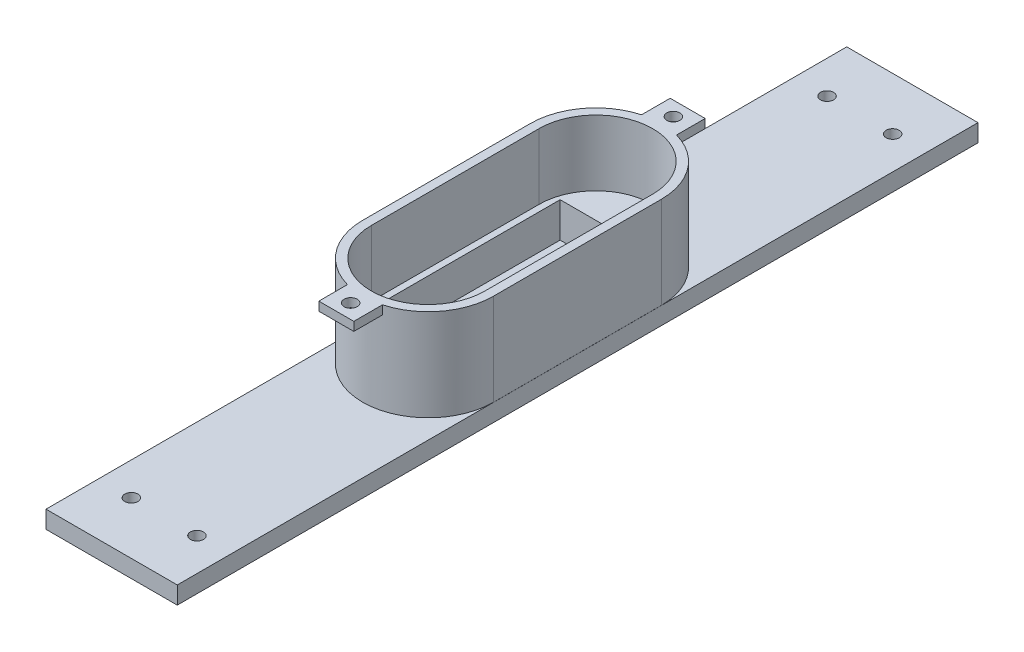
from build123d import *

# Parameters (mm, degrees)
ESQUISSE1_W             = 232.41
ESQUISSE1_H             = 5.08
EXTRU_MINCE1_DEPTH      = 19.05
EXTRU_MINCE2_DEPTH      = 26.67
BOSS_EXTRU_2_DEPTH      = 7.62
ESQUISSE2_W             = 29.21
ESQUISSE2_H             = 57.15
ENL_V_MAT_EXTRU_1_DEPTH = 10.16
ENL_V_MAT_EXTRU_2_REACH = 123.325
ESQUISSE7_R             = 1.65
ESQUISSE8_R             = 10.16
ENL_V_MAT_EXTRU_3_DEPTH = 122.324888729
ESQUISSE9_W             = 10.16
ESQUISSE9_H             = 10.16
BOSS_EXTRU_1_DEPTH      = 2.54
D_GAGEMENT_61_D         = 3.7973
D_GAGEMENT_61_DEPTH     = 2.54
ESQUISSE12_W            = 10.16
ESQUISSE12_H            = 81.28
ENL_V_MAT_EXTRU_4_DEPTH = 3.81
ENL_V_START             = -8.89
ENL_V_MAT_EXTRU_5_DEPTH = 8.89
D_GAGEMENT_62_D         = 3.7973


with BuildPart() as part:
    # Esquisse1 → Extru.-Mince1 (new, symmetric)
    with BuildSketch(Plane(origin=(0, 0, 0), x_dir=(0, 0, -1), z_dir=(1, 0, 0))):
        with Locations((0, 46.628736397)):
            Rectangle(ESQUISSE1_W, ESQUISSE1_H)
    extrude(amount=EXTRU_MINCE1_DEPTH, both=True)

    # Esquisse6 → Extru.-Mince2 (add)
    with BuildSketch(Plane(origin=(0, 49.168736397, 0), x_dir=(1, 0, 0), z_dir=(0, 1, 0))):
        with BuildLine():
            Line((-19.0246, -24.3459), (-19.0246, 24.3459))
            ThreePointArc((-19.0246, 24.3459), (0, 43.3705), (19.0246, 24.3459))
            Line((19.0246, 24.3459), (19.0246, -24.3459))
            ThreePointArc((19.0246, -24.3459), (0, -43.3705), (-19.0246, -24.3459))
        make_face()
        with BuildLine():
            Line((-16.4846, -24.3459), (-16.4846, 24.3459))
            ThreePointArc((-16.4846, 24.3459), (0, 40.8305), (16.4846, 24.3459))
            Line((16.4846, 24.3459), (16.4846, -24.3459))
            ThreePointArc((16.4846, -24.3459), (0, -40.8305), (-16.4846, -24.3459))
        make_face(mode=Mode.SUBTRACT)
    extrude(amount=EXTRU_MINCE2_DEPTH)

    # Esquisse13 → Boss.-Extru.2 (add)
    with BuildSketch(Plane(origin=(0, 49.168736397, 0), x_dir=(1, 0, 0), z_dir=(0, 1, 0))):
        with BuildLine():
            Line((-16.4846, 24.3459), (-16.4846, -24.3459))
            ThreePointArc((-16.4846, -24.3459), (0, -40.8305), (16.4846, -24.3459))
            Line((16.4846, -24.3459), (16.4846, 24.3459))
            ThreePointArc((16.4846, 24.3459), (0, 40.8305), (-16.4846, 24.3459))
        make_face()
    extrude(amount=BOSS_EXTRU_2_DEPTH)

    # Esquisse2 → Enlèv. mat.-Extru.1 (cut)
    with BuildSketch(Plane(origin=(0, 56.788736397, 0), x_dir=(1, 0, 0), z_dir=(0, 1, 0))):
        Rectangle(ESQUISSE2_W, ESQUISSE2_H)
    extrude(amount=-ENL_V_MAT_EXTRU_1_DEPTH, mode=Mode.SUBTRACT)

    # Esquisse7 → Enlèv. mat.-Extru.2 (cut, up to next)
    with BuildSketch(Plane(origin=(0, 46.628736397, 0), x_dir=(1, 0, 0), z_dir=(0, 1, 0)), mode=Mode.PRIVATE) as enl_v_mat_extru_2_sk1:
        with Locations(Location((-9.525, 9.525, 0), (0, 0, 270))):
            Circle(ESQUISSE7_R)
    enl_v_mat_extru_2_tool1 = extrude(enl_v_mat_extru_2_sk1.sketch, amount=-ENL_V_MAT_EXTRU_2_REACH, mode=Mode.PRIVATE) & part.part
    # Esquisse7 → Enlèv. mat.-Extru.2 (cut, up to next)
    with BuildSketch(Plane(origin=(0, 46.628736397, 0), x_dir=(1, 0, 0), z_dir=(0, 1, 0)), mode=Mode.PRIVATE) as enl_v_mat_extru_2_sk2:
        with Locations(Location((9.525, 9.525, 0), (0, 0, 270))):
            Circle(ESQUISSE7_R)
    enl_v_mat_extru_2_tool2 = extrude(enl_v_mat_extru_2_sk2.sketch, amount=-ENL_V_MAT_EXTRU_2_REACH, mode=Mode.PRIVATE) & part.part
    # Esquisse7 → Enlèv. mat.-Extru.2 (cut, up to next)
    with BuildSketch(Plane(origin=(0, 46.628736397, 0), x_dir=(1, 0, 0), z_dir=(0, 1, 0)), mode=Mode.PRIVATE) as enl_v_mat_extru_2_sk3:
        with Locations(Location((9.525, -9.525, 0), (0, 0, 270))):
            Circle(ESQUISSE7_R)
    enl_v_mat_extru_2_tool3 = extrude(enl_v_mat_extru_2_sk3.sketch, amount=-ENL_V_MAT_EXTRU_2_REACH, mode=Mode.PRIVATE) & part.part
    # Esquisse7 → Enlèv. mat.-Extru.2 (cut, up to next)
    with BuildSketch(Plane(origin=(0, 46.628736397, 0), x_dir=(1, 0, 0), z_dir=(0, 1, 0)), mode=Mode.PRIVATE) as enl_v_mat_extru_2_sk4:
        with Locations(Location((-9.525, -9.525, 0), (0, 0, 270))):
            Circle(ESQUISSE7_R)
    enl_v_mat_extru_2_tool4 = extrude(enl_v_mat_extru_2_sk4.sketch, amount=-ENL_V_MAT_EXTRU_2_REACH, mode=Mode.PRIVATE) & part.part
    add(enl_v_mat_extru_2_tool1.solids().sort_by_distance((-9.525, 46.628736, -9.525))[0], mode=Mode.SUBTRACT)
    add(enl_v_mat_extru_2_tool2.solids().sort_by_distance((9.525, 46.628736, -9.525))[0], mode=Mode.SUBTRACT)
    add(enl_v_mat_extru_2_tool3.solids().sort_by_distance((9.525, 46.628736, 9.525))[0], mode=Mode.SUBTRACT)
    add(enl_v_mat_extru_2_tool4.solids().sort_by_distance((-9.525, 46.628736, 9.525))[0], mode=Mode.SUBTRACT)

    # Esquisse8 → Enlèv. mat.-Extru.3 (cut, through all)
    with BuildSketch(Plane(origin=(0, 46.628736397, 0), x_dir=(1, 0, 0), z_dir=(0, 1, 0))):
        with Locations(Location((0, 0, 0), (0, 0, 270))):
            Circle(ESQUISSE8_R)
    extrude(amount=-ENL_V_MAT_EXTRU_3_DEPTH, mode=Mode.SUBTRACT)

    # Esquisse9 → Boss.-Extru.1 (add)
    with BuildSketch(Plane(origin=(0, 75.838736397, 0), x_dir=(1, 0, 0), z_dir=(0, 1, 0))):
        with Locations((0, 45.9105)):
            Rectangle(ESQUISSE9_W, ESQUISSE9_H)
    boss_extru_1 = extrude(amount=-BOSS_EXTRU_1_DEPTH)

    # Dégagement #61
    with Locations(Plane(origin=(0, 75.838736397, 0), x_dir=(1, 0, 0), z_dir=(0, 1, 0))):
        with Locations((0, 46.835110673)):
            d_gagement_61 = Hole(D_GAGEMENT_61_D / 2, depth=D_GAGEMENT_61_DEPTH)

    # Symétrie1: Boss.-Extru.1, Dégagement #61 across plane
    add(boss_extru_1.mirror(Plane.XY))
    add(d_gagement_61.mirror(Plane.XY), mode=Mode.SUBTRACT)

    # Esquisse12 → Enlèv. mat.-Extru.4 (cut)
    with BuildSketch(Plane(origin=(0, 44.088736397, 0), x_dir=(1, 0, 0), z_dir=(0, 1, 0))):
        with Locations((0, -69.215)):
            Rectangle(ESQUISSE12_W, ESQUISSE12_H)
    extrude(amount=ENL_V_MAT_EXTRU_4_DEPTH, mode=Mode.SUBTRACT)

    # Esquisse14 → Enlèv. mat.-Extru.5 (cut)
    with BuildSketch(Plane(origin=(0, 56.788736397, 0), x_dir=(1, 0, 0), z_dir=(0, 1, 0)).offset(ENL_V_START)):
        with BuildLine():
            Line((-5.08, -28.575), (5.08, -28.575))
            Line((5.08, -28.575), (5.08, -40.028235195))
            ThreePointArc((5.08, -40.028235195), (0, -40.8305), (-5.08, -40.028235195))
            Line((-5.08, -40.028235195), (-5.08, -28.575))
        make_face()
    extrude(amount=ENL_V_MAT_EXTRU_5_DEPTH, mode=Mode.SUBTRACT)

    # Dégagement #62 (through all)
    with Locations(Plane(origin=(0, 49.168736397, 0), x_dir=(1, 0, 0), z_dir=(0, 1, 0))):
        with Locations((-9.525, 100.965), (9.525, 100.965), (9.525, -100.965), (-9.525, -100.965)):
            Hole(D_GAGEMENT_62_D / 2)


solid = part.part
